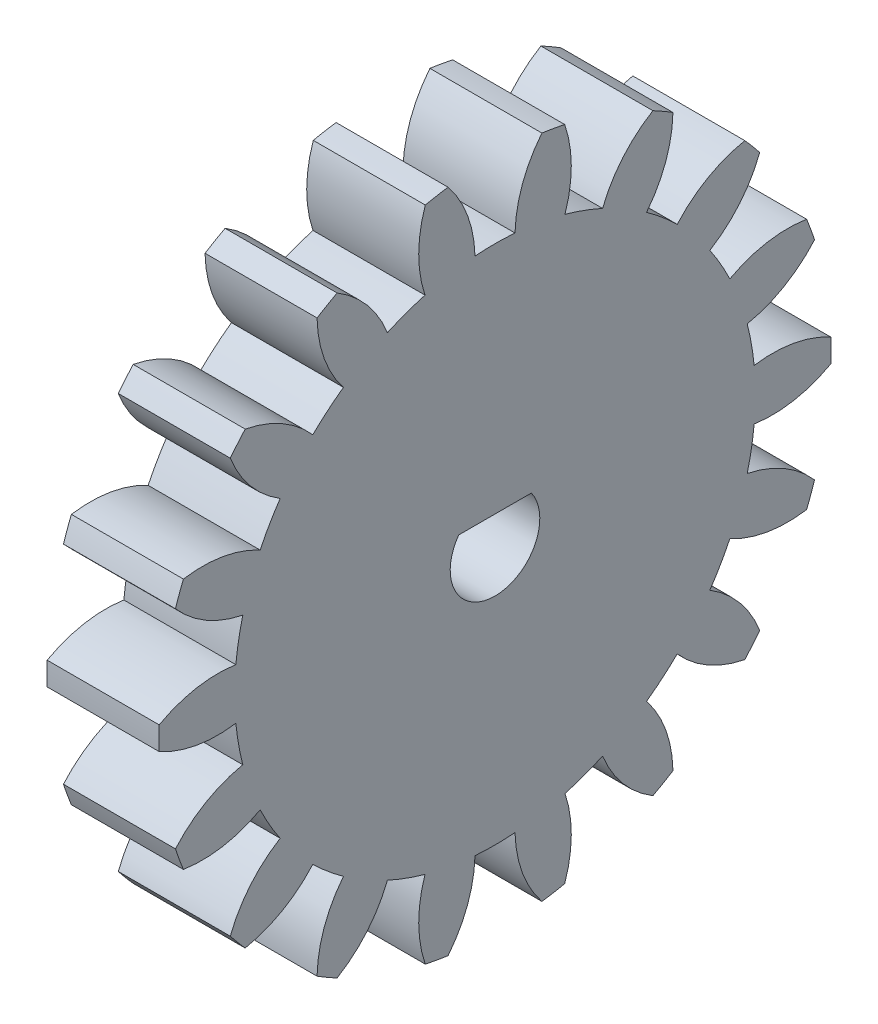
from build123d import *

# Parameters (mm, degrees)
BASPROSKE_W        = 5
BASPROSKE_H        = 15
TOOTHCUT_DEPTH     = 22.794494718
TEETHCUTS_COUNT    = 18
TEETHCUTS_ANGLE    = 340
BORSKE_R           = 0.4
BORE_DEPTH         = 50.0000508
CUT_EXTRUDE1_DEPTH = 22.693670212


with BuildPart() as part:
    # BasProSke → Base-Revolve (revolve)
    with BuildSketch(Plane(origin=(0, 0, 0), x_dir=(1, 0, 0), z_dir=(0, 1, 0)), mode=Mode.PRIVATE) as base_revolve_sk:
        with Locations((2.5, 7.5)):
            Rectangle(BASPROSKE_W, BASPROSKE_H)
    revolve(base_revolve_sk.sketch.rotate(Axis((-10, 0, 0), (1, 0, 0)), 180), axis=Axis((-10, 0, 0), (1, 0, 0)))

    # TooCutSke → ToothCut (cut, through all)
    with BuildSketch(Plane(origin=(0, 0, 0), x_dir=(0, 0, -1), z_dir=(1, 0, 0))):
        with BuildLine():
            ThreePointArc((0.893213978, 11.589630917), (0, 11.624), (-0.893213978, 11.589630917))
            ThreePointArc((-0.893213978, 11.589630917), (-1.228846443, 13.334586644), (-2.112682677, 14.876129102))
            ThreePointArc((-2.112682677, 14.876129102), (0, 15.0254), (2.112682677, 14.876129102))
            ThreePointArc((2.112682677, 14.876129102), (1.228846443, 13.334586644), (0.893213978, 11.589630917))
        make_face()
    toothcut = extrude(amount=TOOTHCUT_DEPTH, mode=Mode.SUBTRACT)

    # TeethCuts: ToothCut ×18 about axis
    teethcuts_axis = Axis((-10, 0, 0), (1, 0, 0))
    for i in range(1, TEETHCUTS_COUNT):
        add(toothcut.rotate(teethcuts_axis, i * TEETHCUTS_ANGLE / (TEETHCUTS_COUNT - 1)), mode=Mode.SUBTRACT)

    # BorSke → Bore (cut, symmetric)
    with BuildSketch(Plane(origin=(0, 0, 0), x_dir=(0, 0, -1), z_dir=(1, 0, 0))):
        with Locations(Location((0, 0, 0), (0, 0, 180))):
            Circle(BORSKE_R)
    extrude(amount=BORE_DEPTH, both=True, mode=Mode.SUBTRACT)

    # Sketch1 → Cut-Extrude1 (cut, through all)
    with BuildSketch(Plane(origin=(5, 0, 0), x_dir=(0, 0, -1), z_dir=(1, 0, 0))):
        with BuildLine():
            Line((1.620880746, 1.171642269), (-1.620880746, 1.171642269))
            ThreePointArc((-1.620880746, 1.171642269), (-0.615726606, -1.9028612), (2, 0))
            ThreePointArc((2, 0), (1.9028612, 0.615726606), (1.620880746, 1.171642269))
        make_face()
    extrude(amount=-CUT_EXTRUDE1_DEPTH, mode=Mode.SUBTRACT)


solid = part.part
